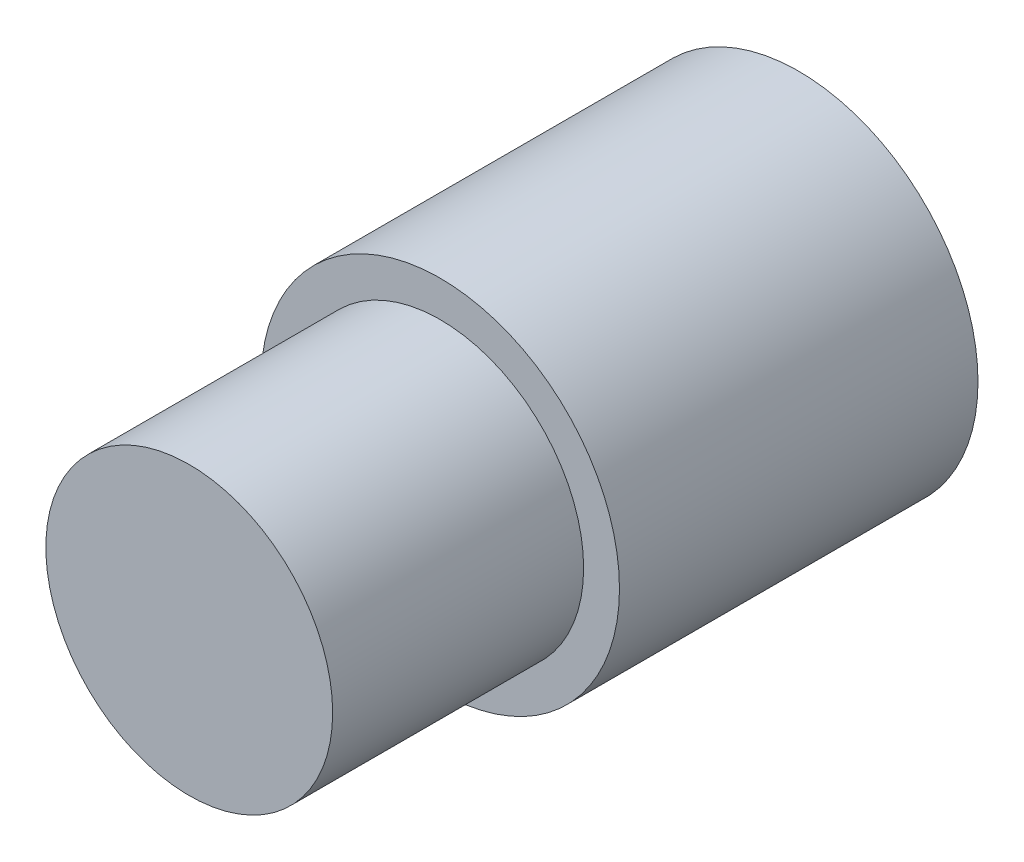
from build123d import *

# Parameters (mm, degrees)
SKETCH1_R           = 5
SKETCH1_R_2         = 1.5
BOSS_EXTRUDE1_DEPTH = 10
SKETCH2_R           = 4
BOSS_EXTRUDE2_DEPTH = 7


with BuildPart() as part:
    # Sketch1 → Boss-Extrude1 (new body)
    with BuildSketch(Plane.XY):
        Circle(SKETCH1_R)
        Circle(SKETCH1_R_2, mode=Mode.SUBTRACT)
    extrude(amount=BOSS_EXTRUDE1_DEPTH)

    # Sketch2 → Boss-Extrude2 (add)
    with BuildSketch(Plane.XY.offset(10)):
        Circle(SKETCH2_R)
    extrude(amount=BOSS_EXTRUDE2_DEPTH)


solid = part.part
